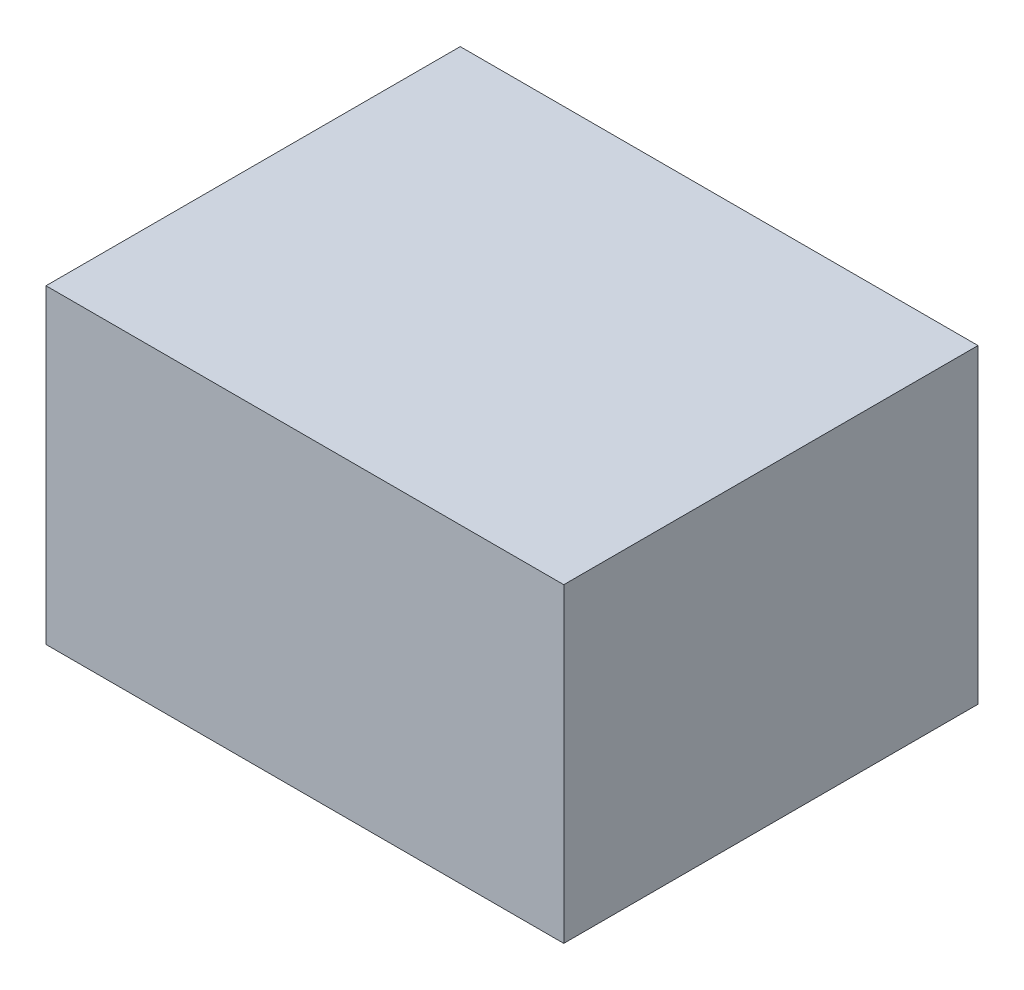
from build123d import *

# Parameters (mm, degrees)
SKETCH_1_W      = 250
SKETCH_1_H      = 200
EXTRUDE_1_DEPTH = 150


with BuildPart() as part:
    # 草图1 → 凸台-拉伸1 (new body)
    with BuildSketch(Plane(origin=(0, 0, 0), x_dir=(1, 0, 0), z_dir=(0, 1, 0))):
        with Locations((25, 100)):
            Rectangle(SKETCH_1_W, SKETCH_1_H)
    extrude(amount=EXTRUDE_1_DEPTH)


solid = part.part
